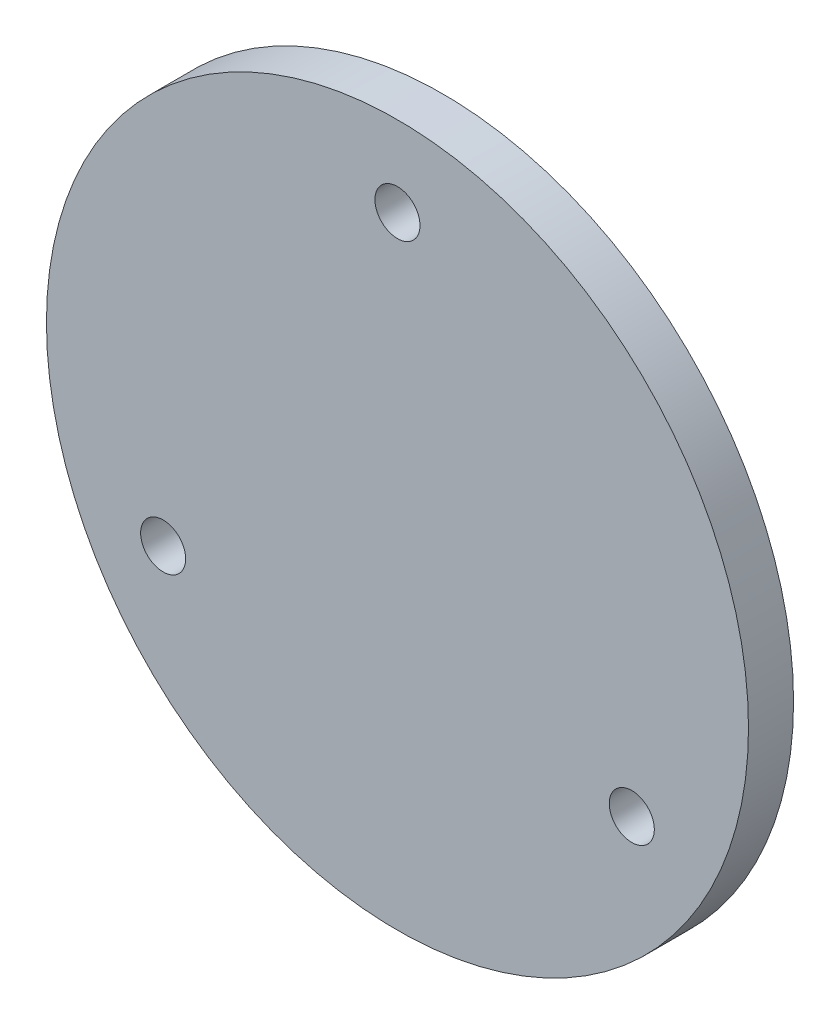
from build123d import *

# Parameters (mm, degrees)
SKETCH1_R           = 49.4665
BOSS_EXTRUDE1_DEPTH = 6.35
SKETCH6_R           = 3.175
CUT_EXTRUDE2_DEPTH  = 71.243802179


with BuildPart() as part:
    # Sketch1 → Boss-Extrude1 (new body)
    with BuildSketch(Plane.XY):
        Circle(SKETCH1_R)
    extrude(amount=BOSS_EXTRUDE1_DEPTH)

    # Sketch6 → Cut-Extrude2 (cut, through all)
    with BuildSketch(Plane.XY.offset(6.35)):
        with Locations((0, 38.128211777)):
            Circle(SKETCH6_R)
        with Locations((-33.02, -19.064105889)):
            Circle(SKETCH6_R)
        with Locations((33.02, -19.064105889)):
            Circle(SKETCH6_R)
    extrude(amount=-CUT_EXTRUDE2_DEPTH, mode=Mode.SUBTRACT)


solid = part.part
